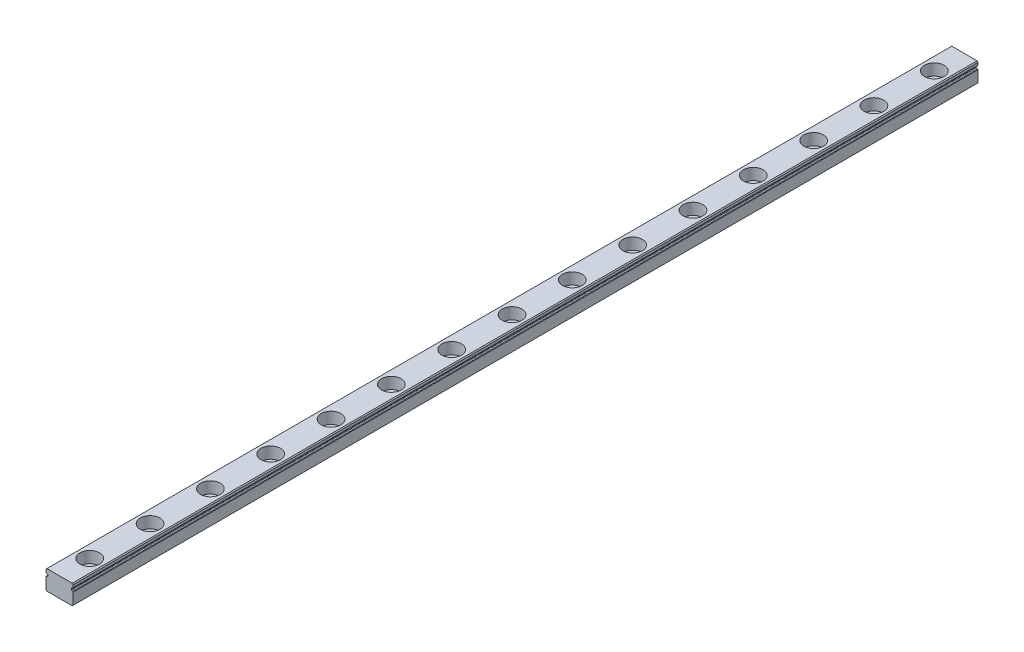
from build123d import *
from OCP.BRepFilletAPI import BRepFilletAPI_MakeChamfer

# Parameters (mm, degrees)
ESQUISSE1_W                                       = 9
ESQUISSE1_H                                       = 6.5
BOSS_EXTRU_1_DEPTH                                = 150
ENL_V_MAT_EXTRU_1_DEPTH                           = 301.051349772
CHANFREIN1_SIZE                                   = 0.3
CONG_1_R                                          = 0.2
CHANFREIN2_SIZE                                   = 0.1
CHANFREIN2_SIZE2                                  = 0.167315719
CHAMBRAGE_POUR_VIS_SIX_PANS_CREUX_M31_D           = 3.6
CHAMBRAGE_POUR_VIS_SIX_PANS_CREUX_M31_CBORE_D     = 6.5
CHAMBRAGE_POUR_VIS_SIX_PANS_CREUX_M31_CBORE_DEPTH = 3.8
R_P_TITION_LIN_AIRE1_COUNT                        = 15
R_P_TITION_LIN_AIRE1_PITCH                        = 20


with BuildPart() as part:
    # Esquisse1 → Boss.-Extru.1 (new, symmetric)
    with BuildSketch(Plane.XY):
        Rectangle(ESQUISSE1_W, ESQUISSE1_H)
    extrude(amount=BOSS_EXTRU_1_DEPTH, both=True)

    # Esquisse2 → Enlèv. mat.-Extru.1 (cut, through all)
    with BuildSketch(Plane(origin=(0, 0, -150), x_dir=(-1, 0, 0), z_dir=(0, 0, -1))):
        Polygon((-4.5, 1.968382141), (-3.9, 1.75), (-3.9, 1.15), (-4.5, 0.931617859), align=None)
    enl_v_mat_extru_1 = extrude(amount=-ENL_V_MAT_EXTRU_1_DEPTH, mode=Mode.SUBTRACT)

    # Symétrie1: Enlèv. mat.-Extru.1 across plane
    add(enl_v_mat_extru_1.mirror(Plane(origin=(0, 0, 0), x_dir=(0, 0, 1), z_dir=(1, 0, 0))), mode=Mode.SUBTRACT)

    # Chanfrein1
    chanfrein1_edges = [part.edges().sort_by_distance(p)[0] for p in [
        (-4.5, 3.25, 0),
        (4.5, 3.25, 0),
        (4.5, -3.25, 0),
        (-4.5, -3.25, 0),
    ]]
    chamfer(chanfrein1_edges, length=CHANFREIN1_SIZE)

    # Congé1
    cong_1_edges = [part.edges().sort_by_distance(p)[0] for p in [
        (3.9, 1.75, 0),
        (3.9, 1.15, 0),
        (-3.9, 1.15, 0),
        (-3.9, 1.75, 0),
    ]]
    fillet(cong_1_edges, radius=CONG_1_R)

    # Chanfrein2: one chamfer whose edges measure the first distance from different faces: ONE call of the kernel's chamfer builder (chamfer() names one face for all edges)
    chanfrein2_edges_1 = [part.edges().sort_by_distance(p)[0] for p in [
        (4.5, 0.931617859, 0),
    ]]
    chanfrein2_side_1 = [part.faces().sort_by_distance(p)[0] for p in [
        (4.5, -1.00919107, 0),
    ]]
    chanfrein2_edges_2 = [part.edges().sort_by_distance(p)[0] for p in [
        (4.5, 1.968382141, 0),
    ]]
    chanfrein2_side_2 = [part.faces().sort_by_distance(p)[0] for p in [
        (4.265797986, 1.883139579, 0),
    ]]
    chanfrein2_edges_3 = [part.edges().sort_by_distance(p)[0] for p in [
        (-4.5, 1.968382141, 0),
    ]]
    chanfrein2_side_3 = [part.faces().sort_by_distance(p)[0] for p in [
        (-4.5, 2.45919107, 0),
    ]]
    chanfrein2_edges_4 = [part.edges().sort_by_distance(p)[0] for p in [
        (-4.5, 0.931617859, 0),
    ]]
    chanfrein2_side_4 = [part.faces().sort_by_distance(p)[0] for p in [
        (-4.265797986, 1.016860421, 0),
    ]]
    chanfrein2 = BRepFilletAPI_MakeChamfer(part.part.solid().wrapped)
    for e in chanfrein2_edges_1:
        chanfrein2.Add(CHANFREIN2_SIZE, CHANFREIN2_SIZE2, e.wrapped, chanfrein2_side_1[0].wrapped)  # the first distance lies on this face
    for e in chanfrein2_edges_2:
        chanfrein2.Add(CHANFREIN2_SIZE, CHANFREIN2_SIZE2, e.wrapped, chanfrein2_side_2[0].wrapped)  # the first distance lies on this face
    for e in chanfrein2_edges_3:
        chanfrein2.Add(CHANFREIN2_SIZE, CHANFREIN2_SIZE2, e.wrapped, chanfrein2_side_3[0].wrapped)  # the first distance lies on this face
    for e in chanfrein2_edges_4:
        chanfrein2.Add(CHANFREIN2_SIZE, CHANFREIN2_SIZE2, e.wrapped, chanfrein2_side_4[0].wrapped)  # the first distance lies on this face
    add(Compound.cast(chanfrein2.Shape()), mode=Mode.REPLACE)

    # Chambrage pour vis à six pans creux M31 (through all)
    with Locations(Plane(origin=(0, 3.25, 0), x_dir=(1, 0, 0), z_dir=(0, 1, 0))):
        with Locations((0, 140)):
            chambrage_pour_vis_six_pans_creux_m31 = CounterBoreHole(CHAMBRAGE_POUR_VIS_SIX_PANS_CREUX_M31_D / 2, CHAMBRAGE_POUR_VIS_SIX_PANS_CREUX_M31_CBORE_D / 2, CHAMBRAGE_POUR_VIS_SIX_PANS_CREUX_M31_CBORE_DEPTH)

    # Répétition linéaire1: Chambrage pour vis à six pans creux M31 ×15
    with Locations(*[(0, 0, i * R_P_TITION_LIN_AIRE1_PITCH) for i in range(1, R_P_TITION_LIN_AIRE1_COUNT)]):
        add(chambrage_pour_vis_six_pans_creux_m31, mode=Mode.SUBTRACT)


solid = part.part
